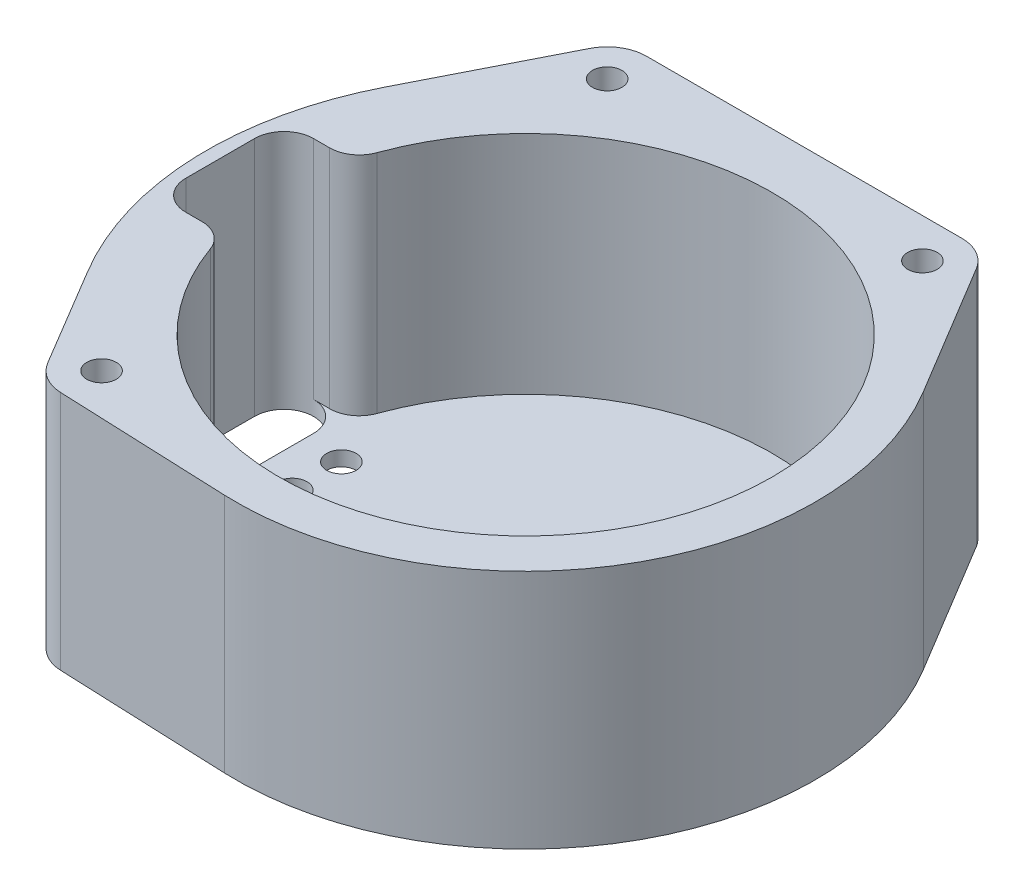
from build123d import *
from build123d.topology import SkipClean

# Parameters (mm, degrees)
SKETCH1_R           = 1.5
BOSS_EXTRUDE2_DEPTH = 23
FILLET1_R           = 3
BOSS_EXTRUDE3_START = 1.5
SKETCH2_R           = 6
SKETCH2_R_2         = 1.5
BOSS_EXTRUDE3_DEPTH = 1.5
SKETCH4_R           = 1.5
CUT_EXTRUDE1_DEPTH  = 2


with BuildPart() as part:
    # Sketch1 → Boss-Extrude2 (new body)
    with BuildSketch(Plane(origin=(0, 0, 0), x_dir=(1, 0, 0), z_dir=(0, 1, 0))):
        with BuildLine():
            Line((-21.843209551, -26.818382995), (-27.908610167, -16.654112961))
            ThreePointArc((-27.908610167, -16.654112961), (-32.480873767, -1.114827051), (-28.984811413, 14.701384538))
            Line((-28.984811413, 14.701384538), (-21.975665089, 28.520408444))
            ThreePointArc((-21.975665089, 28.520408444), (-20.501434748, 30.119643705), (-18.408303684, 30.71100727))
            Line((-18.408303684, 30.71100727), (13.688017257, 30.71100727))
            ThreePointArc((13.688017257, 30.71100727), (15.65662404, 30.193045083), (17.115398886, 28.773300936))
            Line((17.115398886, 28.773300936), (25.276939518, 15.209415788))
            ThreePointArc((25.276939518, 15.209415788), (25.378046342, -15.040105181), (-1.205158785, -29.475372641))
            Line((-1.205158785, -29.475372641), (-18.571715045, -28.765306712))
            ThreePointArc((-18.571715045, -28.765306712), (-20.4539331, -28.205999691), (-21.843209551, -26.818382995))
        make_face()
        with Locations(Location((13.688017257, 26.71100727, 0), (0, 0, 270))):
            Circle(SKETCH1_R, mode=Mode.SUBTRACT)
        with Locations(Location((-18.408303684, 26.71100727, 0), (0, 0, 270))):
            Circle(SKETCH1_R, mode=Mode.SUBTRACT)
        with Locations(Location((-18.408303684, -24.768646015, 0), (0, 0, 270))):
            Circle(SKETCH1_R, mode=Mode.SUBTRACT)
        with BuildLine():
            Line((-31.1, -6.5), (-31.1, 6.5))
            Line((-31.1, 6.5), (-24.243762084, 6.5))
            ThreePointArc((-24.243762084, 6.5), (25.1, 0), (-24.243762084, -6.5))
            Line((-24.243762084, -6.5), (-31.1, -6.5))
        make_face(mode=Mode.SUBTRACT)
    extrude(amount=BOSS_EXTRUDE2_DEPTH)

    # Fillet1
    fillet1_edges = [part.edges().sort_by_distance(p)[0] for p in [
        (-31.1, 11.5, 6.5),
        (-24.243762084, 11.5, 6.5),
        (-24.243762084, 11.5, -6.5),
        (-31.1, 11.5, -6.5),
    ]]
    fillet(fillet1_edges, radius=FILLET1_R)

    # Sketch2 → Boss-Extrude3 (add)
    with SkipClean():  # the faces are left unmerged after this step: merging them gives an invalid solid
        with BuildSketch(Plane.XZ.offset(BOSS_EXTRUDE3_START)):
            with BuildLine():
                Line((-18.408303684, -30.71100727), (13.688017257, -30.71100727))
                ThreePointArc((13.688017257, -30.71100727), (15.65662404, -30.193045083), (17.115398886, -28.773300936))
                Line((17.115398886, -28.773300936), (25.276939518, -15.209415788))
                ThreePointArc((25.276939518, -15.209415788), (25.378046342, 15.040105181), (-1.205158785, 29.475372641))
                Line((-1.205158785, 29.475372641), (-18.571715045, 28.765306712))
                ThreePointArc((-18.571715045, 28.765306712), (-20.4539331, 28.205999691), (-21.843209551, 26.818382995))
                Line((-21.843209551, 26.818382995), (-27.908610167, 16.654112961))
                ThreePointArc((-27.908610167, 16.654112961), (-32.480873767, 1.114827051), (-28.984811413, -14.701384538))
                Line((-28.984811413, -14.701384538), (-21.975665089, -28.520408444))
                ThreePointArc((-21.975665089, -28.520408444), (-20.501434748, -30.119643705), (-18.408303684, -30.71100727))
            make_face()
            with Locations(Location((0, 0, 0), (0, 0, 270))):
                Circle(SKETCH2_R, mode=Mode.SUBTRACT)
            with Locations(Location((13.688017257, -26.71100727, 0), (0, 0, 270))):
                Circle(SKETCH2_R_2, mode=Mode.SUBTRACT)
            with Locations(Location((-18.408303684, -26.71100727, 0), (0, 0, 270))):
                Circle(SKETCH2_R_2, mode=Mode.SUBTRACT)
            with Locations(Location((-18.408303684, 24.768646015, 0), (0, 0, 270))):
                Circle(SKETCH2_R_2, mode=Mode.SUBTRACT)
            with BuildLine():
                Line((-25.1, 3.5), (-25.1, -3.5))
                ThreePointArc((-25.1, -3.5), (-28.1, -6.5), (-31.1, -3.5))
                Line((-31.1, -3.5), (-31.1, 3.5))
                ThreePointArc((-31.1, 3.5), (-28.1, 6.5), (-25.1, 3.5))
            make_face(mode=Mode.SUBTRACT)
        extrude(amount=-BOSS_EXTRUDE3_DEPTH)

    # Sketch4 → Cut-Extrude1 (cut)
    with SkipClean():  # the faces are left unmerged after this step: merging them gives an invalid solid
        with BuildSketch(Plane.XZ.offset(1.5)):
            with Locations(Location((-21.170923397, 2.587343919, 0), (0, 0, 270))):
                Circle(SKETCH4_R)
            with Locations(Location((-21.170923616, -2.412654174, 0), (0, 0, 270))):
                Circle(SKETCH4_R)
        extrude(amount=-CUT_EXTRUDE1_DEPTH, mode=Mode.SUBTRACT)


solid = part.part
